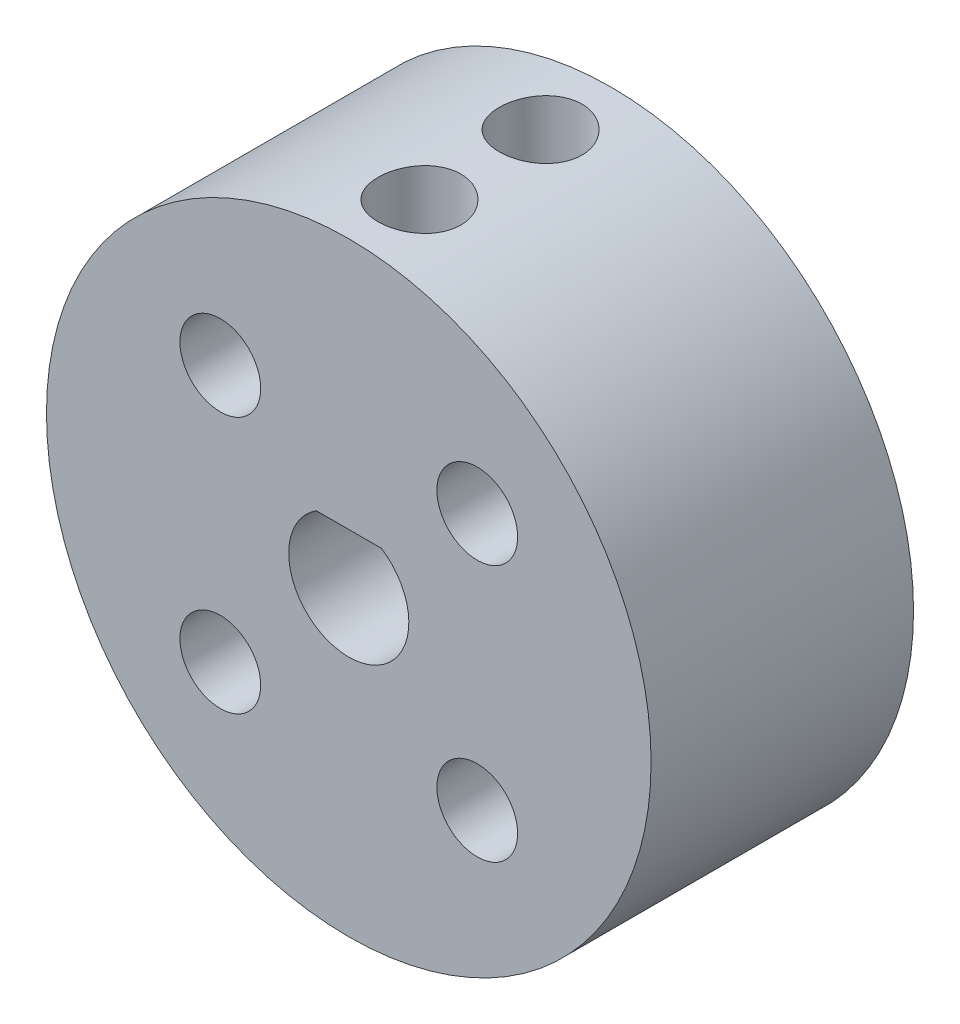
from build123d import *

# Parameters (mm, degrees)
SKETCH1_R           = 14.975
BOSS_EXTRUDE1_DEPTH = 13
SKETCH3_R           = 2.05
CUT_EXTRUDE2_DEPTH  = 16
CUT_EXTRUDE7_DEPTH  = 5
SKETCH12_R          = 2
CUT_EXTRUDE8_DEPTH  = 23.638490621
SKETCH13_R          = 2.975
CUT_EXTRUDE9_DEPTH  = 1


with BuildPart() as part:
    # Sketch1 → Boss-Extrude1 (new body)
    with BuildSketch(Plane.XY):
        with Locations(Location((0, 0, 0), (0, 0, 180))):
            Circle(SKETCH1_R)
        with BuildLine():
            Line((1.612645342, 2.5), (-1.612645342, 2.5))
            ThreePointArc((-1.612645342, 2.5), (0, -2.975), (1.612645342, 2.5))
        make_face(mode=Mode.SUBTRACT)
    extrude(amount=BOSS_EXTRUDE1_DEPTH)

    # Sketch3 → Cut-Extrude2 (cut)
    with BuildSketch(Plane(origin=(0, 0, 0), x_dir=(1, 0, 0), z_dir=(0, 1, 0))):
        with Locations(Location((0, -3.5, 0), (0, 0, 90))):
            Circle(SKETCH3_R)
        with Locations(Location((0, -9.5, 0), (0, 0, 90))):
            Circle(SKETCH3_R)
    extrude(amount=CUT_EXTRUDE2_DEPTH, mode=Mode.SUBTRACT)

    # Sketch11 → Cut-Extrude7 (cut)
    with BuildSketch(Plane(origin=(0, 0, 0), x_dir=(-1, 0, 0), z_dir=(0, 0, -1))):
        Polygon((-6.363961031, 2.380244173), (-2.913961031, 4.372102602), (-2.913961031, 8.355819459), (-6.363961031, 10.347677888), (-9.813961031, 8.355819459), (-9.813961031, 4.372102602), align=None)
        Polygon((9.813961031, 8.355819459), (6.363961031, 10.347677888), (2.913961031, 8.355819459), (2.913961031, 4.372102602), (6.363961031, 2.380244173), (9.813961031, 4.372102602), align=None)
        Polygon((9.813961031, -4.372102602), (9.813961031, -8.355819459), (6.363961031, -10.347677888), (2.913961031, -8.355819459), (2.913961031, -4.372102602), (6.363961031, -2.380244173), align=None)
        Polygon((-9.813961031, -4.372102602), (-6.363961031, -2.380244173), (-2.913961031, -4.372102602), (-2.913961031, -8.355819459), (-6.363961031, -10.347677888), (-9.813961031, -8.355819459), align=None)
    extrude(amount=-CUT_EXTRUDE7_DEPTH, mode=Mode.SUBTRACT)

    # Sketch12 → Cut-Extrude8 (cut, through all)
    with BuildSketch(Plane(origin=(0, 0, 5), x_dir=(-1, 0, 0), z_dir=(0, 0, -1))):
        with Locations((-6.363961031, 6.363961031)):
            Circle(SKETCH12_R)
        with Locations((6.363961031, 6.363961031)):
            Circle(SKETCH12_R)
        with Locations((6.363961031, -6.363961031)):
            Circle(SKETCH12_R)
        with Locations((-6.363961031, -6.363961031)):
            Circle(SKETCH12_R)
    extrude(amount=-CUT_EXTRUDE8_DEPTH, mode=Mode.SUBTRACT)

    # Sketch13 → Cut-Extrude9 (cut)
    with BuildSketch(Plane(origin=(0, 0, 0), x_dir=(-1, 0, 0), z_dir=(0, 0, -1))):
        with Locations(Location((0, 0, 0), (0, 0, 57.175631627))):
            Circle(SKETCH13_R)
    extrude(amount=-CUT_EXTRUDE9_DEPTH, mode=Mode.SUBTRACT)


solid = part.part
